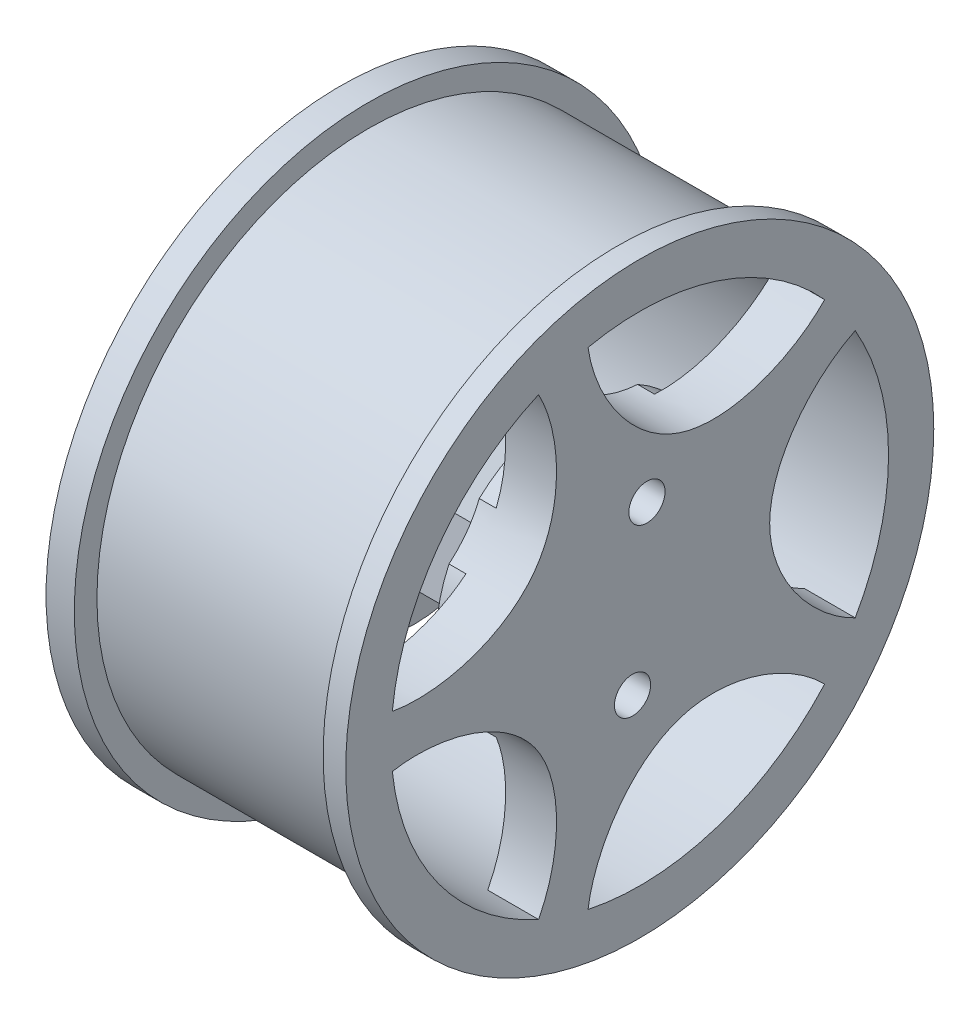
from build123d import *
from build123d.topology import SkipClean

# Parameters (mm, degrees)
SKETCH3_R           = 26
BOSS_EXTRUDE1_DEPTH = 26.5
SKETCH5_R           = 26
SKETCH5_R_2         = 24
CUT_EXTRUDE1_DEPTH  = 22
SKETCH2_R           = 1.6
CUT_EXTRUDE2_DEPTH  = 136.127294
CUT_EXTRUDE3_DEPTH  = 17
SKETCH8_R           = 22
CUT_EXTRUDE6_DEPTH  = 14
CUT_EXTRUDE8_START  = -22
SKETCH10_R          = 22
SKETCH10_R_2        = 12
CUT_EXTRUDE8_DEPTH  = 22
SKETCH11_R          = 9
CUT_EXTRUDE9_DEPTH  = 7
BOSS_EXTRUDE2_START = -20.5
BOSS_EXTRUDE2_DEPTH = 20.5
SKETCH13_R          = 12
CUT_EXTRUDE10_DEPTH = 2


with BuildPart() as part:
    # Sketch3 → Boss-Extrude1 (new body)
    with BuildSketch(Plane(origin=(0, 0, 0), x_dir=(0, 0, -1), z_dir=(1, 0, 0))):
        with Locations((-65.677419, 69.668105)):
            Circle(SKETCH3_R)
    extrude(amount=-BOSS_EXTRUDE1_DEPTH)

    # Sketch5 → Cut-Extrude1 (cut)
    with BuildSketch(Plane(origin=(-2, 0, 0), x_dir=(0, 0, -1), z_dir=(1, 0, 0))):
        with Locations((-65.677419, 69.668105)):
            Circle(SKETCH5_R)
        with Locations((-65.677419, 69.668105)):
            Circle(SKETCH5_R_2, mode=Mode.SUBTRACT)
    extrude(amount=-CUT_EXTRUDE1_DEPTH, mode=Mode.SUBTRACT)

    # Sketch2 → Cut-Extrude2 (cut, through all)
    with BuildSketch(Plane(origin=(0, 0, 0), x_dir=(0, 0, -1), z_dir=(1, 0, 0))):
        with Locations((-65.040125, 76.739445)):
            Circle(SKETCH2_R)
        with Locations((-66.314714, 62.596764)):
            Circle(SKETCH2_R)
    extrude(amount=-CUT_EXTRUDE2_DEPTH, mode=Mode.SUBTRACT)

    # Sketch6 → Cut-Extrude3 (cut)
    with BuildSketch(Plane(origin=(0, 0, 0), x_dir=(0, 0, -1), z_dir=(1, 0, 0))):
        with BuildLine():
            ThreePointArc((-74.625626, 89.766105), (-83.475793, 82.59938), (-87.556901, 71.967731))
            add(Edge.make_bspline(
                [(-87.556901, 71.967731), (-83.305208, 71.217142), (-71.994026, 74.257388), (-72.597927, 85.954449), (-74.625626, 89.766105)],
                knots=[0, 0, 0, 0, 0.5, 1, 1, 1, 1], degree=3))
        make_face()
        with BuildLine():
            ThreePointArc((-49.328233, 84.388978), (-58.879046, 90.591348), (-70.251477, 91.187352))
            add(Edge.make_bspline(
                [(-70.251477, 91.187352), (-69.651484, 86.911806), (-63.26469, 77.093722), (-52.32674, 81.282656), (-49.328233, 84.388978)],
                knots=[0, 0, 0, 0, 0.5, 1, 1, 1, 1], degree=3))
        make_face()
        with BuildLine():
            ThreePointArc((-46.624861, 58.668105), (-43.677419, 69.668105), (-46.624861, 80.668105))
            add(Edge.make_bspline(
                [(-46.624861, 80.668105), (-50.505738, 78.776261), (-57.869664, 69.668105), (-50.505738, 60.559948), (-46.624861, 58.668105)],
                knots=[0, 0, 0, 0, 0.5, 1, 1, 1, 1], degree=3))
        make_face()
        with BuildLine():
            ThreePointArc((-70.251477, 48.148857), (-58.879046, 48.744861), (-49.328233, 54.947231))
            add(Edge.make_bspline(
                [(-49.328233, 54.947231), (-52.32674, 58.053553), (-63.26469, 62.242488), (-69.651484, 52.424403), (-70.251477, 48.148857)],
                knots=[0, 0, 0, 0, 0.5, 1, 1, 1, 1], degree=3))
        make_face()
        with BuildLine():
            ThreePointArc((-87.556901, 67.368479), (-83.475793, 56.736829), (-74.625626, 49.570105))
            add(Edge.make_bspline(
                [(-74.625626, 49.570105), (-72.597927, 53.381761), (-71.994026, 65.078821), (-83.305208, 68.119068), (-87.556901, 67.368479)],
                knots=[0, 0, 0, 0, 0.5, 1, 1, 1, 1], degree=3))
        make_face()
    extrude(amount=-CUT_EXTRUDE3_DEPTH, mode=Mode.SUBTRACT)

    # Sketch8 → Cut-Extrude6 (cut)
    with SkipClean():  # the faces are left unmerged after this step: merging them gives an invalid solid
        with BuildSketch(Plane(origin=(-6, 0, 0), x_dir=(0, 0, -1), z_dir=(1, 0, 0))):
            with Locations((-65.677419, 69.668105)):
                Circle(SKETCH8_R)
        extrude(amount=-CUT_EXTRUDE6_DEPTH, mode=Mode.SUBTRACT)

    # Sketch10 → Cut-Extrude8 (cut)
    with BuildSketch(Plane.ZY.offset(26.5).offset(CUT_EXTRUDE8_START)):
        with Locations(Location((65.677419, 69.668105, 0), (0, 0, 210))):
            Circle(SKETCH10_R)
        with Locations((65.677419, 69.668105)):
            Circle(SKETCH10_R_2, mode=Mode.SUBTRACT)
    extrude(amount=CUT_EXTRUDE8_DEPTH, mode=Mode.SUBTRACT)


with BuildPart() as cut_extrude8_piece_1:
    # of the separate pieces the step leaves, piece 1, a body of its own (cut_extrude8_pieces)
    add(part.part.solids().sort_by_distance((0, 69.668105, 39.677419))[0])



with BuildPart() as cut_extrude8_piece_2:
    # of the separate pieces the step leaves, piece 2, a body of its own (cut_extrude8_pieces)
    add(part.part.solids().sort_by_distance((-20, 69.668105, 77.677419))[0])

    # Sketch11 → Cut-Extrude9 (cut)
    with BuildSketch(Plane.ZY.offset(26.5)):
        with Locations((53.725858, 68.590987)):
            Circle(SKETCH11_R)
        with Locations((77.628981, 70.745223)):
            Circle(SKETCH11_R)
    extrude(amount=-CUT_EXTRUDE9_DEPTH, mode=Mode.SUBTRACT)


with BuildPart() as cut_extrude8_piece_1_1:
    add(cut_extrude8_piece_1.part)

    add(cut_extrude8_piece_2.part)  # Boss-Extrude2 merges Cut-Extrude8 piece 2
    # Sketch12 → Boss-Extrude2 (add)
    with BuildSketch(Plane.ZY.offset(26.5).offset(BOSS_EXTRUDE2_START)):
        Polygon((59.387479, 72.615418), (71.339041, 73.692536), (71.96736, 66.720792), (60.015798, 65.643674), align=None)
    extrude(amount=BOSS_EXTRUDE2_DEPTH)

    # Sketch13 → Cut-Extrude10 (cut)
    with BuildSketch(Plane.ZY.offset(26.5)):
        with Locations((65.677419, 69.668105)):
            Circle(SKETCH13_R)
    extrude(amount=-CUT_EXTRUDE10_DEPTH, mode=Mode.SUBTRACT)


solid = cut_extrude8_piece_1_1.part
